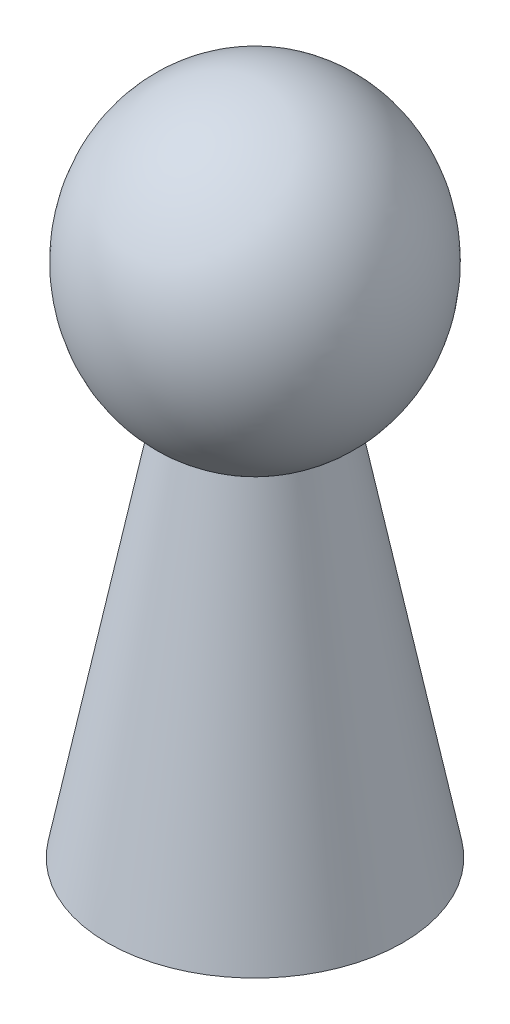
from build123d import *


with BuildPart() as part:
    # Esquisse1 → Révolution1 (revolve)
    with BuildSketch(Plane.XY, mode=Mode.PRIVATE) as r_volution1_sk:
        with BuildLine():
            Line((0, 0), (8.9, 0))
            Line((8.9, 0), (4.4, 23))
            add(Edge.make_bspline(
                [(4.4, 23), (32.441089218, 40.5), (0, 40.5)],
                knots=[0.526901074, 0.526901074, 0.526901074, 3.141592654, 3.141592654, 3.141592654], degree=2, weights=[1, 0.260413579, 1]))
            Line((0, 40.5), (0, 0))
        make_face()
    revolve(r_volution1_sk.sketch.rotate(Axis((0, 6.842529865, 0), (0, -1, 0)), 90), axis=Axis((0, 6.842529865, 0), (0, -1, 0)))


solid = part.part
